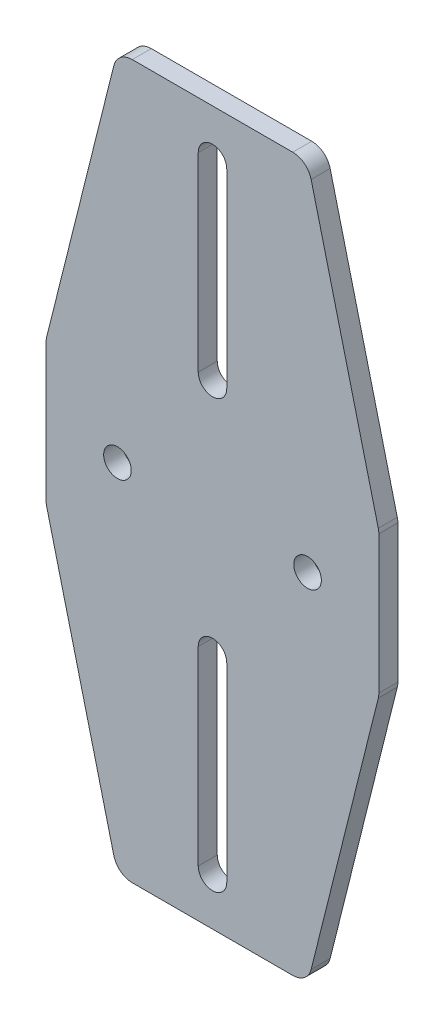
from build123d import *

# Parameters (mm, degrees)
EXTRUDE_1_DEPTH     = 2
SKETCH_2_R          = 1.45
CUT_EXTRUDE_1_DEPTH = 58.043842788
FILLET_1_R          = 2


with BuildPart() as part:
    # 草图1 → 凸台-拉伸1 (new body)
    with BuildSketch(Plane.XY):
        Polygon((0, 0), (7.5, 30), (27.5, 30), (35, 0), (35, -15), (27.5, -45), (7.5, -45), (0, -15), align=None)
    extrude(amount=EXTRUDE_1_DEPTH)

    # 草图2 → 切除-拉伸1 (cut, through all)
    with BuildSketch(Plane.XY.offset(2)):
        with Locations((7.5, -7.5)):
            Circle(SKETCH_2_R)
        with Locations(Location((27.5, -7.5, 0), (0, 0, 180))):
            Circle(SKETCH_2_R)
        with BuildLine():
            Line((19, 25), (19, 5))
            ThreePointArc((19, 5), (17.5, 3.5), (16, 5))
            Line((16, 5), (16, 25))
            ThreePointArc((16, 25), (17.5, 26.5), (19, 25))
        make_face()
        with BuildLine():
            Line((19, -40), (19, -20))
            ThreePointArc((19, -20), (17.5, -18.5), (16, -20))
            Line((16, -20), (16, -40))
            ThreePointArc((16, -40), (17.5, -41.5), (19, -40))
        make_face()
    extrude(amount=-CUT_EXTRUDE_1_DEPTH, mode=Mode.SUBTRACT)

    # 圆角1
    fillet_1_edges = [part.edges().sort_by_distance(p)[0] for p in [
        (0, 0, 1),
        (7.5, 30, 1),
        (27.5, 30, 1),
        (35, 0, 1),
        (35, -15, 1),
        (27.5, -45, 1),
        (7.5, -45, 1),
        (0, -15, 1),
    ]]
    fillet(fillet_1_edges, radius=FILLET_1_R)


solid = part.part
